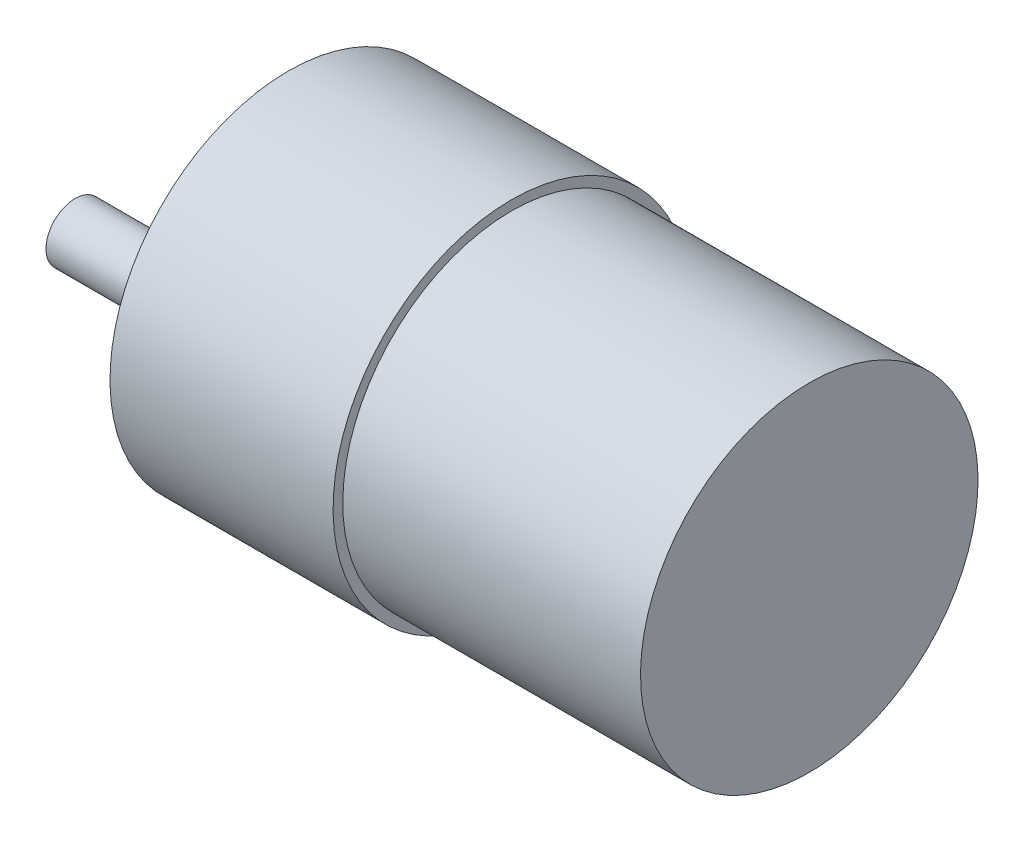
from build123d import *

# Parameters (mm, degrees)
SKETCH3_R           = 3
BOSS_EXTRUDE1_DEPTH = 22
SKETCH3_3_R         = 6
BOSS_EXTRUDE2_DEPTH = 6
SKETCH4_R           = 1.5
CUT_EXTRUDE1_DEPTH  = 6


with BuildPart() as part:
    # Sketch2 → Revolve1 (revolve)
    with BuildSketch(Plane.XY):
        Polygon((0, 0), (0, 18.4), (23, 18.4), (23, 17.4), (53.7, 17.4), (53.7, 0), align=None)
    revolve(axis=Axis((53.7, 0, 0), (-1, 0, 0)))

    # Sketch3 → Boss-Extrude1 (add)
    with BuildSketch(Plane.ZY):
        with Locations((0, -7)):
            Circle(SKETCH3_R)
    extrude(amount=BOSS_EXTRUDE1_DEPTH)

    # Sketch3<3> → Boss-Extrude2 (add)
    with BuildSketch(Plane.ZY):
        with Locations((0, -7)):
            Circle(SKETCH3_3_R)
    extrude(amount=BOSS_EXTRUDE2_DEPTH)

    # Sketch4 → Cut-Extrude1 (cut)
    with BuildSketch(Plane.ZY):
        with Locations((15.5, 0)):
            Circle(SKETCH4_R)
        with Locations((7.75, -13.423393759)):
            Circle(SKETCH4_R)
        with Locations((-7.75, -13.423393759)):
            Circle(SKETCH4_R)
        with Locations((-15.5, 0)):
            Circle(SKETCH4_R)
        with Locations((-7.75, 13.423393759)):
            Circle(SKETCH4_R)
        with Locations((7.75, 13.423393759)):
            Circle(SKETCH4_R)
    extrude(amount=-CUT_EXTRUDE1_DEPTH, mode=Mode.SUBTRACT)


solid = part.part
